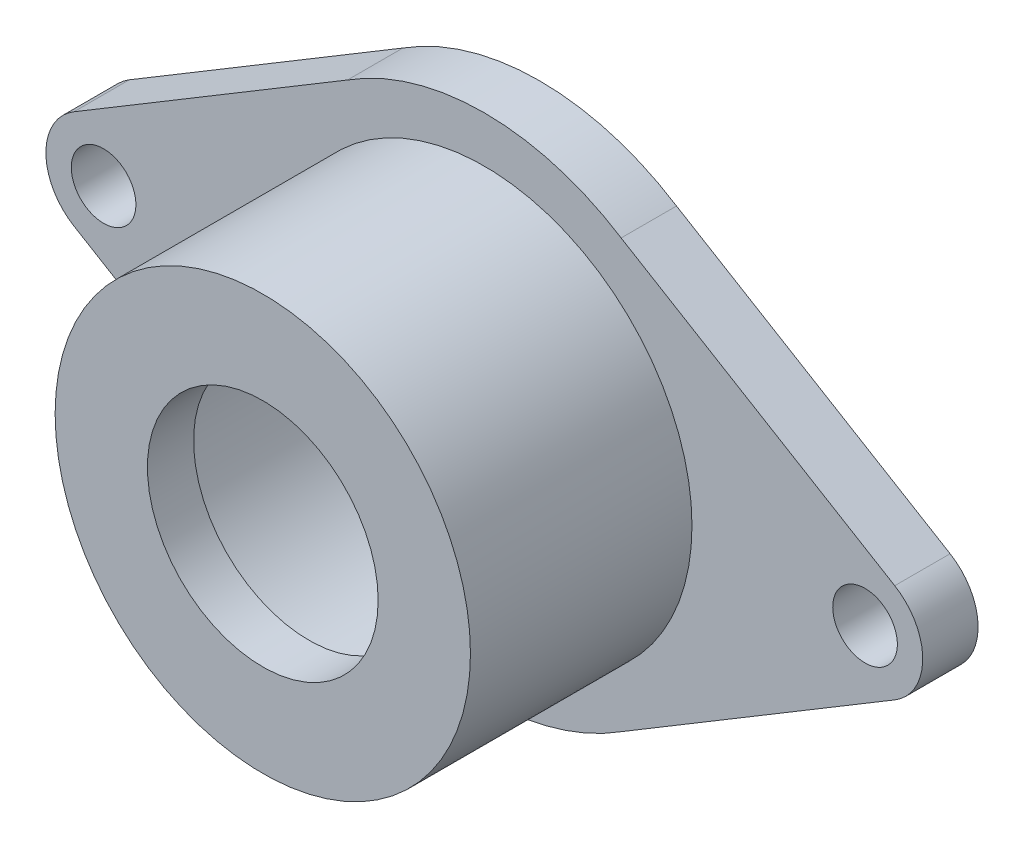
from build123d import *

# Parameters (mm, degrees)
BOSS_EXTRUDE1_START = -12
SKETCH3_R           = 45
BOSS_EXTRUDE1_DEPTH = 12
SKETCH4_R           = 7
CUT_EXTRUDE1_DEPTH  = 12


with BuildPart() as part:
    # Sketch1 → Revolve2 (revolve)
    with BuildSketch(Plane(origin=(0, 0, 0), x_dir=(0, 0, -1), z_dir=(1, 0, 0)), mode=Mode.PRIVATE) as revolve2_sk:
        Polygon((-109.471153846, -8.509615385), (-59.471153846, -8.509615385), (-59.471153846, 1.490384615), (-119.471153846, 1.490384615), (-119.471153846, -18.509615385), (-109.471153846, -18.509615385), align=None)
    revolve(revolve2_sk.sketch.rotate(Axis((0, -43.509615385, 119.471153846), (0, 0, -1)), 90), axis=Axis((0, -43.509615385, 119.471153846), (0, 0, -1)))

    # Sketch3 → Boss-Extrude1 (add)
    with BuildSketch(Plane(origin=(0, 0, 59.471153846), x_dir=(-1, 0, 0), z_dir=(0, 0, -1)).offset(BOSS_EXTRUDE1_START)):
        with BuildLine():
            Line((-29.647715243, -89.834694778), (-88.936024476, -54.225378957))
            ThreePointArc((-88.936024476, -54.225378957), (-95, -43.509615385), (-88.936024476, -32.793851812))
            Line((-88.936024476, -32.793851812), (-29.647715243, 2.815464009))
            ThreePointArc((-29.647715243, 2.815464009), (0, 11.490384615), (29.647715243, 2.815464009))
            Line((29.647715243, 2.815464009), (88.936024476, -32.793851812))
            ThreePointArc((88.936024476, -32.793851812), (95, -43.509615385), (88.936024476, -54.225378958))
            Line((88.936024476, -54.225378958), (29.647715243, -89.834694778))
            ThreePointArc((29.647715243, -89.834694778), (0, -98.509615385), (-29.647715243, -89.834694778))
        make_face()
        with Locations(Location((0, -43.509615385, 0), (0, 0, 180))):
            Circle(SKETCH3_R, mode=Mode.SUBTRACT)
    extrude(amount=BOSS_EXTRUDE1_DEPTH)

    # Sketch4 → Cut-Extrude1 (cut)
    with BuildSketch(Plane(origin=(0, 0, 59.471153846), x_dir=(-1, 0, 0), z_dir=(0, 0, -1))):
        with Locations((-82.5, -43.509615385)):
            Circle(SKETCH4_R)
        with Locations((82.5, -43.509615385)):
            Circle(SKETCH4_R)
    extrude(amount=-CUT_EXTRUDE1_DEPTH, mode=Mode.SUBTRACT)


solid = part.part
